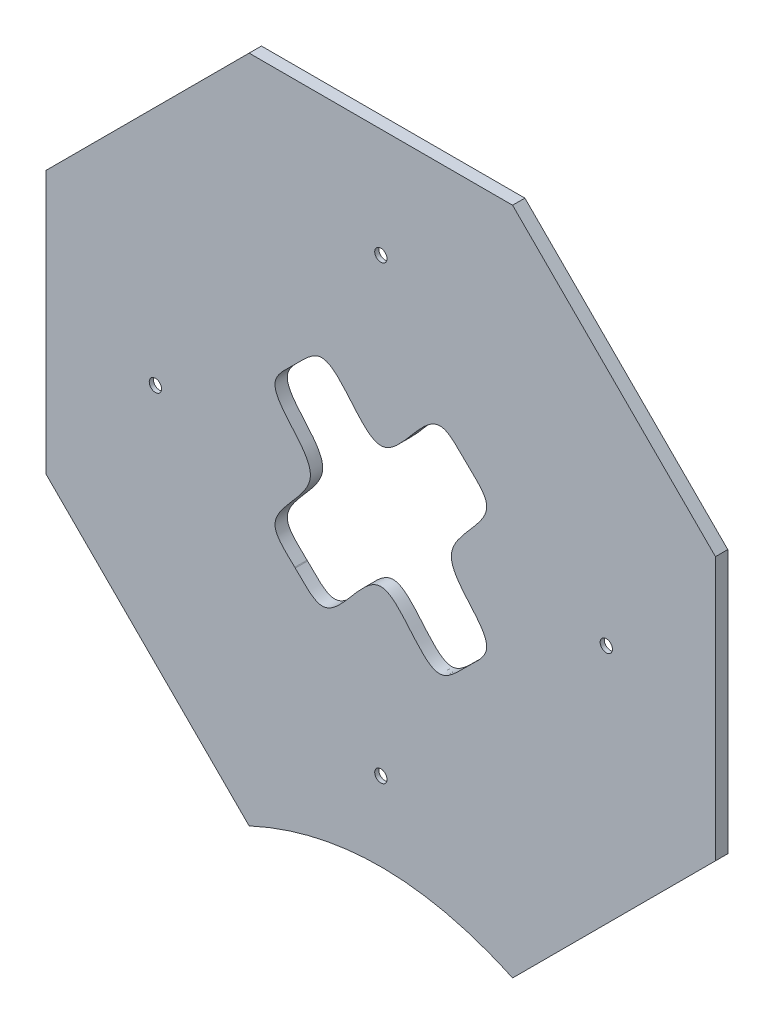
from build123d import *

# Parameters (mm, degrees)
BOSS_EXTRUDE1_DEPTH  = 3
SKETCH2_R            = 1.5
CUT_EXTRUDE1_DEPTH   = 3
SKETCH3_R            = 30
SKETCH3_R_2          = 15
CUT_EXTRUDE2_DEPTH   = 3
SKETCH4_R            = 18
BOSS_EXTRUDE6_DEPTH  = 3
SKETCH5_R            = 15
BOSS_EXTRUDE7_DEPTH  = 3
SKETCH6_R            = 15.225419419
BOSS_EXTRUDE8_DEPTH  = 3
SKETCH7_R            = 1.5
CUT_EXTRUDE4_DEPTH   = 3
SKETCH9_R            = 10
CUT_EXTRUDE5_DEPTH   = 3
SKETCH10_R           = 19.155501788
BOSS_EXTRUDE9_DEPTH  = 3
SKETCH11_R           = 13.756788871
BOSS_EXTRUDE10_DEPTH = 3
SKETCH12_R           = 11.549228796
BOSS_EXTRUDE11_DEPTH = 3
SKETCH14_R           = 9.610550559
BOSS_EXTRUDE12_DEPTH = 3
SKETCH15_R           = 14.086691916
BOSS_EXTRUDE13_DEPTH = 3
SKETCH16_R           = 15.543730799
BOSS_EXTRUDE14_DEPTH = 3
SKETCH17_R           = 14.681473261
BOSS_EXTRUDE17_DEPTH = 3
SKETCH18_R           = 13.614072274
BOSS_EXTRUDE18_DEPTH = 3
SKETCH19_R           = 1.5
CUT_EXTRUDE6_DEPTH   = 10
SKETCH20_R           = 5
CUT_EXTRUDE8_DEPTH   = 2
CUT_EXTRUDE11_DEPTH  = 14


with BuildPart() as part:
    # Sketch1 → Boss-Extrude1 (new body)
    with BuildSketch(Plane.XY):
        with BuildLine():
            Line((-32.133468612, 81.630943295), (32.133468612, 81.630943295))
            Line((32.133468612, 81.630943295), (81.630943295, 32.133468612))
            Line((81.630943295, 32.133468612), (81.630943295, -32.133468612))
            Line((81.630943295, -32.133468612), (32.133468612, -81.630943295))
            add(Edge.make_bspline(
                [(-32.133468612, -81.630943295), (-26.315604905, -78.929469601), (-17.458466972, -75.90692924), (-6.459846686, -74.366971031), (0.503945588, -74.095540146), (13.381410653, -74.737409183), (24.194527132, -77.919288079), (32.133468612, -81.630943295)],
                knots=[0, 0, 0, 0, 0.289771888, 0.418866631, 0.500125988, 0.604148798, 1, 1, 1, 1], degree=3))
            Line((-32.133468612, -81.630943295), (-81.630943295, -32.133468612))
            Line((-81.630943295, -32.133468612), (-81.630943295, 32.133468612))
            Line((-81.630943295, 32.133468612), (-32.133468612, 81.630943295))
        make_face()
    extrude(amount=BOSS_EXTRUDE1_DEPTH)

    # Sketch2 → Cut-Extrude1 (cut)
    with BuildSketch(Plane.XY.offset(3)):
        with Locations((-39.204536424, -39.204536424)):
            Circle(SKETCH2_R)
        with Locations((39.204536424, -39.204536424)):
            Circle(SKETCH2_R)
        with Locations((39.204536424, 39.204536424)):
            Circle(SKETCH2_R)
        with Locations((-39.204536424, 39.204536424)):
            Circle(SKETCH2_R)
    extrude(amount=-CUT_EXTRUDE1_DEPTH, mode=Mode.SUBTRACT)

    # Sketch3 → Cut-Extrude2 (cut)
    with BuildSketch(Plane.XY.offset(3)):
        Circle(SKETCH3_R)
        with Locations((0, 30)):
            Circle(SKETCH3_R_2)
        Circle(SKETCH3_R)
        with Locations((0, 30)):
            Circle(SKETCH3_R_2)
        with Locations((0, -30)):
            Circle(SKETCH3_R_2)
        Circle(SKETCH3_R)
        with Locations((30, 0)):
            Circle(SKETCH3_R_2)
        with Locations((0, 30)):
            Circle(SKETCH3_R_2)
        with Locations((-30, 0)):
            Circle(SKETCH3_R_2)
        Circle(SKETCH3_R)
        with Locations((-30, 0)):
            Circle(SKETCH3_R_2)
        Circle(SKETCH3_R)
        with Locations((0, -30)):
            Circle(SKETCH3_R_2)
        Circle(SKETCH3_R)
        with Locations((30, 0)):
            Circle(SKETCH3_R_2)
        Circle(SKETCH3_R)
        with Locations((30, 0)):
            Circle(SKETCH3_R_2)
        Circle(SKETCH3_R)
        with Locations((0, -30)):
            Circle(SKETCH3_R_2)
        Circle(SKETCH3_R)
        with Locations((-30, 0)):
            Circle(SKETCH3_R_2)
    extrude(amount=-CUT_EXTRUDE2_DEPTH, mode=Mode.SUBTRACT)

    # Sketch4 → Boss-Extrude6 (add)
    with BuildSketch(Plane.XY.offset(3)):
        with Locations((-35.186247216, 0)):
            Circle(SKETCH4_R)
        with Locations((35.19, 0)):
            Circle(SKETCH4_R)
    extrude(amount=-BOSS_EXTRUDE6_DEPTH)

    # Sketch5 → Boss-Extrude7 (add)
    with BuildSketch(Plane.XY.offset(3)):
        with Locations((0, -30)):
            Circle(SKETCH5_R)
    extrude(amount=-BOSS_EXTRUDE7_DEPTH)

    # Sketch6 → Boss-Extrude8 (add)
    with BuildSketch(Plane.XY.offset(3)):
        with Locations((0, 30)):
            Circle(SKETCH6_R)
    extrude(amount=-BOSS_EXTRUDE8_DEPTH)

    # Sketch7 → Cut-Extrude4 (cut)
    with BuildSketch(Plane.XY.offset(3)):
        with Locations((-46.253324199, 32.134700114)):
            Circle(SKETCH7_R)
        with Locations((-52.103605786, -20.865299886)):
            Circle(SKETCH7_R)
        with Locations((34.896394214, -20.865299886)):
            Circle(SKETCH7_R)
        with Locations((34.896394214, 32.134700114)):
            Circle(SKETCH7_R)
    extrude(amount=-CUT_EXTRUDE4_DEPTH, mode=Mode.SUBTRACT)

    # Sketch9 → Cut-Extrude5 (cut)
    with BuildSketch(Plane.XY.offset(3)):
        with Locations((0, 65.004511024)):
            Circle(SKETCH9_R)
        with Locations((0, -51.773637368)):
            Circle(SKETCH9_R)
        with Locations((-62.186247216, 0)):
            Circle(SKETCH9_R)
        with Locations((62.19, 0)):
            Circle(SKETCH9_R)
    extrude(amount=-CUT_EXTRUDE5_DEPTH, mode=Mode.SUBTRACT)

    # Sketch10 → Boss-Extrude9 (add)
    with BuildSketch(Plane.XY.offset(3)):
        with Locations((-48.672279754, -29.553895966)):
            Circle(SKETCH10_R)
    extrude(amount=-BOSS_EXTRUDE9_DEPTH)

    # Sketch11 → Boss-Extrude10 (add)
    with BuildSketch(Plane.XY.offset(3)):
        with Locations((37.212476286, -30.975829013)):
            Circle(SKETCH11_R)
    extrude(amount=-BOSS_EXTRUDE10_DEPTH)

    # Sketch12 → Boss-Extrude11 (add)
    with BuildSketch(Plane.XY.offset(3)):
        with Locations((38.591163572, 36.494236376)):
            Circle(SKETCH12_R)
    extrude(amount=-BOSS_EXTRUDE11_DEPTH)

    # Sketch14 → Boss-Extrude12 (add)
    with BuildSketch(Plane.XY.offset(3)):
        with Locations((-42.212724403, 37.609741157)):
            Circle(SKETCH14_R)
    extrude(amount=-BOSS_EXTRUDE12_DEPTH)

    # Sketch15 → Boss-Extrude13 (add)
    with BuildSketch(Plane.XY.offset(3)):
        with Locations((0, -51.773637368)):
            Circle(SKETCH15_R)
    extrude(amount=-BOSS_EXTRUDE13_DEPTH)

    # Sketch16 → Boss-Extrude14 (add)
    with BuildSketch(Plane.XY.offset(3)):
        with Locations((-63.76815814, 0)):
            Circle(SKETCH16_R)
    extrude(amount=-BOSS_EXTRUDE14_DEPTH)

    # Sketch17 → Boss-Extrude17 (add)
    with BuildSketch(Plane.XY.offset(3)):
        with Locations((-0.058768436, 63.845084824)):
            Circle(SKETCH17_R)
    extrude(amount=-BOSS_EXTRUDE17_DEPTH)

    # Sketch18 → Boss-Extrude18 (add)
    with BuildSketch(Plane(origin=(0, 0, 0), x_dir=(-1, 0, 0), z_dir=(0, 0, -1))):
        with Locations((-63.543622385, 0)):
            Circle(SKETCH18_R)
    extrude(amount=-BOSS_EXTRUDE18_DEPTH)

    # Sketch19 → Cut-Extrude6 (cut)
    with BuildSketch(Plane(origin=(0, 0, 0), x_dir=(-1, 0, 0), z_dir=(0, 0, -1))):
        with Locations((0, 55)):
            Circle(SKETCH19_R)
        with Locations((55, 0)):
            Circle(SKETCH19_R)
        with Locations((0, -55)):
            Circle(SKETCH19_R)
        with Locations((-55, 0)):
            Circle(SKETCH19_R)
    extrude(amount=-CUT_EXTRUDE6_DEPTH, mode=Mode.SUBTRACT)

    # Sketch20 → Cut-Extrude8 (cut)
    with BuildSketch(Plane(origin=(0, 0, 0), x_dir=(-1, 0, 0), z_dir=(0, 0, -1))):
        with Locations((0, 55)):
            Circle(SKETCH20_R)
        with Locations((55, 0)):
            Circle(SKETCH20_R)
        with Locations((0, -55)):
            Circle(SKETCH20_R)
        with Locations((-55, 0)):
            Circle(SKETCH20_R)
    extrude(amount=-CUT_EXTRUDE8_DEPTH, mode=Mode.SUBTRACT)

    # Sketch21 → Cut-Extrude11 (cut)
    with BuildSketch(Plane(origin=(0, 0, 0), x_dir=(-1, 0, 0), z_dir=(0, 0, -1))):
        with BuildLine():
            add(Edge.make_bspline(
                [(-25.779143223, 15.343916538), (-25.444782602, 17.404426932), (-20.814862678, 21.253079788), (-11.928002545, 31.54538853), (1.317e-05, 2.953987482), (11.927707302, 31.545045431), (20.814157023, 21.253821997), (30.670361401, 13.0612405), (7.851072174, 0.001919986), (30.702175927, -13.101903603), (20.72807921, -21.32903317), (11.794640134, -31.622543771), (1.2848e-05, -3.377971787), (-11.794933778, -31.622888023), (-20.72878866, -21.328293053), (-30.702340419, -13.101151105), (-7.858122441, 0.001919089), (-26.533922641, 10.69255887), (-25.779143223, 15.343916538)],
                knots=[0, 0, 0, 0, 0.037620183, 0.075240365, 0.165070914, 0.254901463, 0.292516948, 0.330132434, 0.415069121, 0.500005809, 0.538178927, 0.576352045, 0.665075111, 0.753798177, 0.791975991, 0.830153805, 0.915076903, 1, 1, 1, 1], degree=3))
        make_face()
    extrude(amount=-CUT_EXTRUDE11_DEPTH, mode=Mode.SUBTRACT)


solid = part.part
